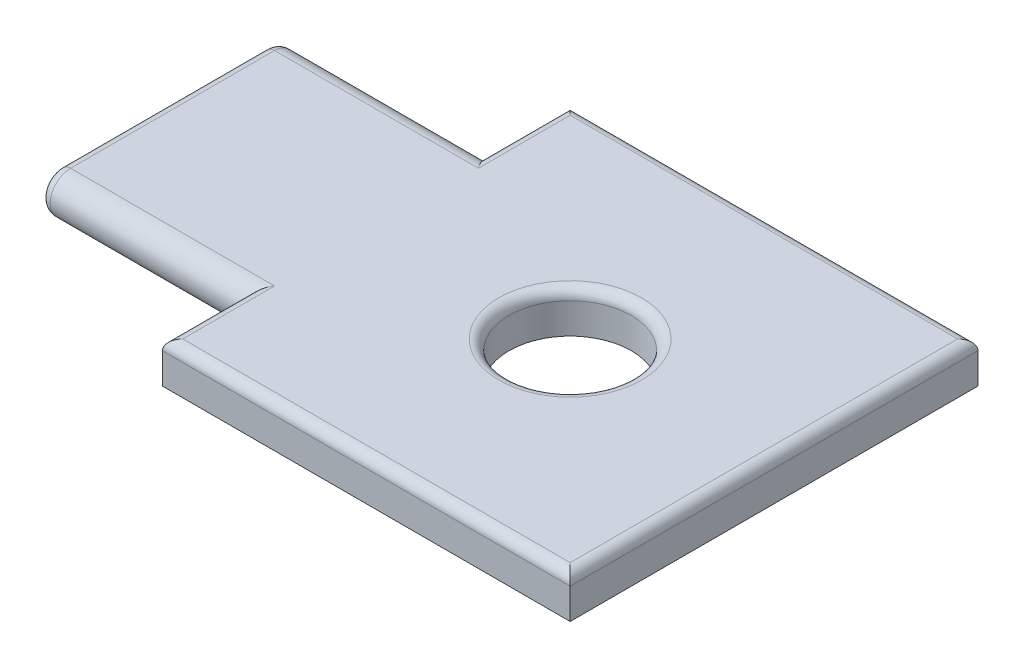
from build123d import *

# Parameters (mm, degrees)
SKETCH2_W           = 200
SKETCH2_H           = 200
SKETCH2_R           = 30
BOSS_EXTRUDE2_DEPTH = 20
BOSS_EXTRUDE3_DEPTH = 100
FILLET1_R           = 5


with BuildPart() as part:
    # Sketch2 → Boss-Extrude2 (new body)
    with BuildSketch(Plane(origin=(0, 0, 0), x_dir=(1, 0, 0), z_dir=(0, 1, 0))):
        Rectangle(SKETCH2_W, SKETCH2_H)
        with Locations(Location((0, 0, 0), (0, 0, 270))):
            Circle(SKETCH2_R, mode=Mode.SUBTRACT)
    extrude(amount=BOSS_EXTRUDE2_DEPTH)

    # Sketch4 → Boss-Extrude3 (add)
    with BuildSketch(Plane.ZY.offset(100)):
        with BuildLine():
            Line((-50, 20), (50, 20))
            ThreePointArc((50, 20), (60, 10), (50, 0))
            Line((50, 0), (-50, 0))
            ThreePointArc((-50, 0), (-60, 10), (-50, 20))
        make_face()
    extrude(amount=BOSS_EXTRUDE3_DEPTH)

    # Fillet1
    fillet1_edges = [part.edges().sort_by_distance(p)[0] for p in [
        (0, 20, -30),
        (-100, 20, -75),
        (0, 20, 100),
        (-100, 20, 75),
        (-200, 10, -60),
        (-200, 0, 0),
        (-200, 10, 60),
        (-200, 20, 0),
        (100, 20, 0),
        (0, 20, -100),
    ]]
    fillet(fillet1_edges, radius=FILLET1_R)


solid = part.part
